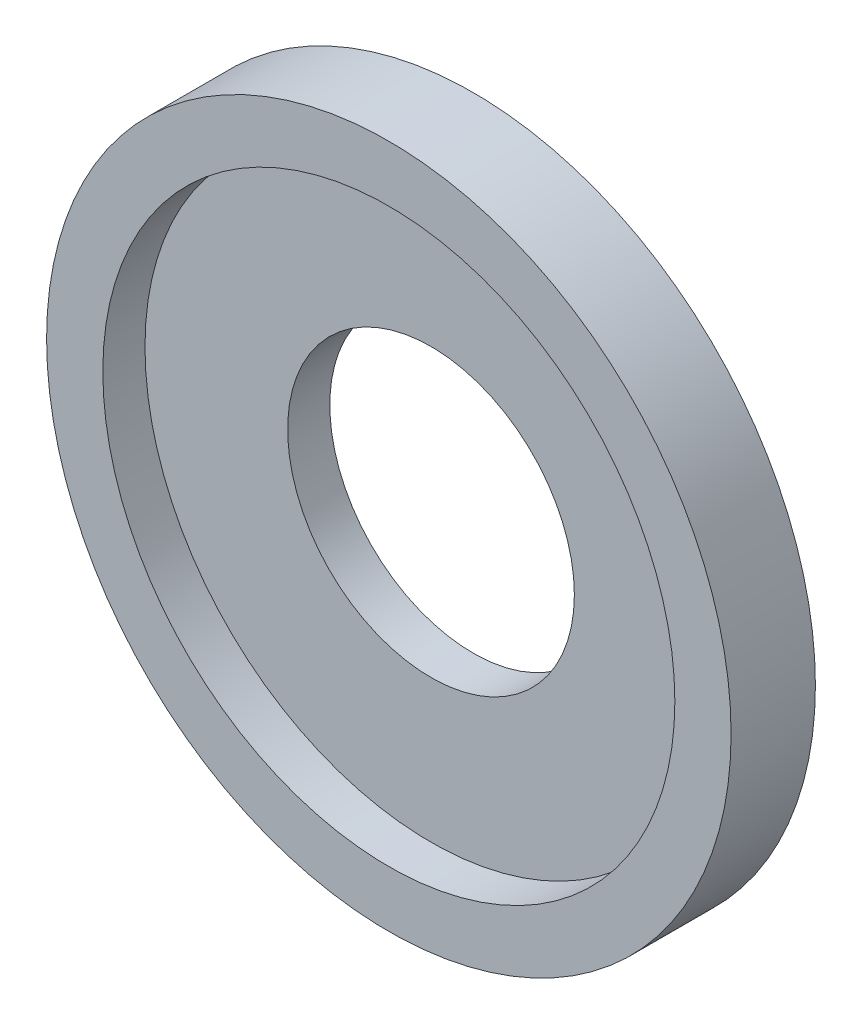
from build123d import *

# Parameters (mm, degrees)
SKETCH1_R           = 12.175
SKETCH1_R_2         = 10.175
BOSS_EXTRUDE1_DEPTH = 3
SKETCH2_R           = 12.175
SKETCH2_R_2         = 5.1
BOSS_EXTRUDE2_DEPTH = 1.5


with BuildPart() as part:
    # Sketch1 → Boss-Extrude1 (new body)
    with BuildSketch(Plane.XY):
        Circle(SKETCH1_R)
        Circle(SKETCH1_R_2, mode=Mode.SUBTRACT)
    extrude(amount=BOSS_EXTRUDE1_DEPTH)

    # Sketch2 → Boss-Extrude2 (add)
    with BuildSketch(Plane.XY):
        Circle(SKETCH2_R)
        Circle(SKETCH2_R_2, mode=Mode.SUBTRACT)
    extrude(amount=BOSS_EXTRUDE2_DEPTH)


solid = part.part
